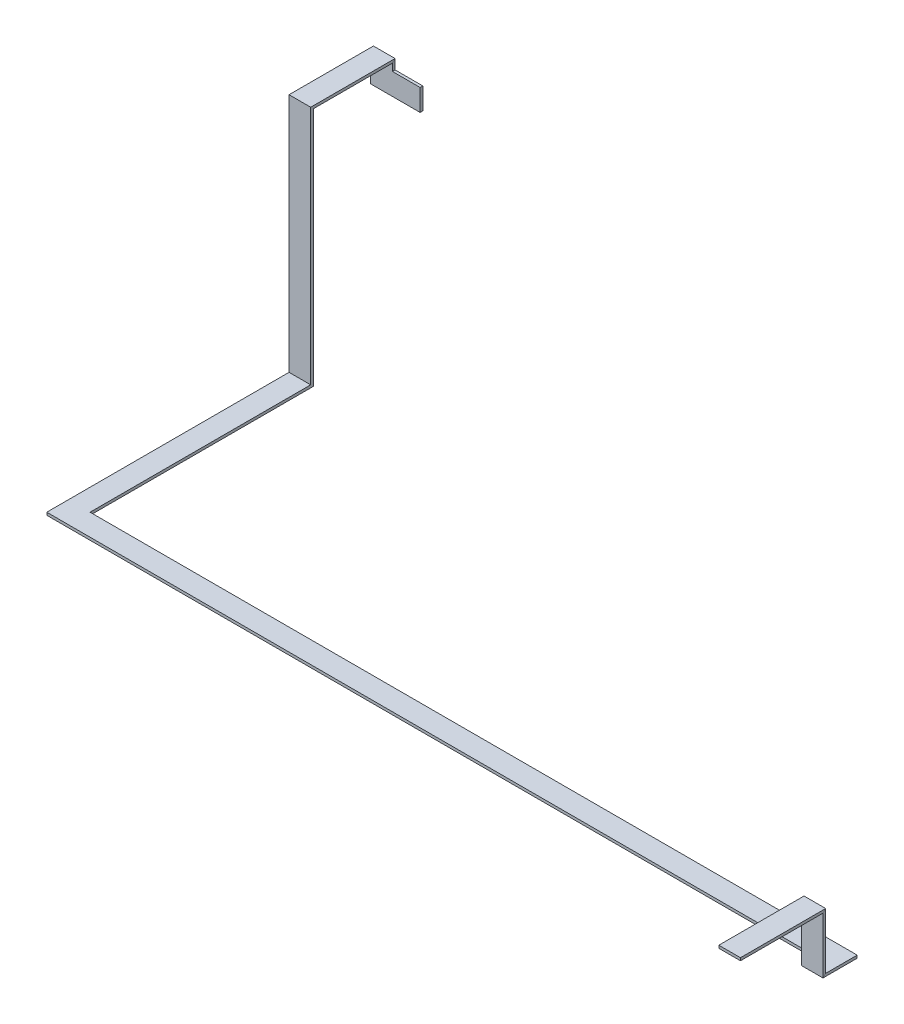
from build123d import *

# Parameters (mm, degrees)
CROQUIS2_W              = 50.8
CROQUIS2_H              = 570.39
SALIENTE_EXTRUIR1_DEPTH = 6.31
CROQUIS3_W              = 50.8
CROQUIS3_H              = 6.31
SALIENTE_EXTRUIR2_DEPTH = 568.44
CROQUIS4_W              = 50.8
CROQUIS4_H              = 6.31
SALIENTE_EXTRUIR3_DEPTH = 1800
CROQUIS6_W              = 50.8
CROQUIS6_H              = 6.31
CROQUIS9_W              = 50.8
CROQUIS9_H              = 6.31
CROQUIS10_W             = 6.31
CROQUIS10_H             = 50.8
SALIENTE_EXTRUIR4_DEPTH = 65


with BuildPart() as part:
    # Croquis2 → Saliente-Extruir1 (new body)
    with BuildSketch(Plane.XY):
        Rectangle(CROQUIS2_W, CROQUIS2_H)
    extrude(amount=SALIENTE_EXTRUIR1_DEPTH)

    # Croquis3 → Saliente-Extruir2 (add)
    with BuildSketch(Plane.XY.offset(6.31)):
        with Locations((0, -282.04)):
            Rectangle(CROQUIS3_W, CROQUIS3_H)
    extrude(amount=SALIENTE_EXTRUIR2_DEPTH)

    # Croquis4 → Saliente-Extruir3 (add)
    with BuildSketch(Plane(origin=(25.4, 0, 0), x_dir=(0, 0, -1), z_dir=(1, 0, 0))):
        with Locations((-549.35, -282.04)):
            Rectangle(CROQUIS4_W, CROQUIS4_H)
    extrude(amount=SALIENTE_EXTRUIR3_DEPTH)

    # Barrer1: sweep along a curve in space
    with BuildLine() as barrer1_path:
        Line((0, 282.04, 0), (0, 282.04, -188.52))
        Line((0, 282.04, -188.52), (0, 211.24, -188.52))
    # Croquis6 → Barrer1 (sweep)
    with BuildSketch(Plane(origin=(0, 0, 0), x_dir=(-1, 0, 0), z_dir=(0, 0, -1))):
        with Locations((0, 282.04)):
            Rectangle(CROQUIS6_W, CROQUIS6_H)
    sweep(path=barrer1_path.line, transition=Transition.RIGHT)

    # Barrer2: sweep along a curve in space
    with BuildLine() as barrer2_path:
        Line((1800, -282.04, 574.75), (1800, -282.04, 601.16))
        Line((1800, -282.04, 601.16), (1800, -150.28, 601.16))
        Line((1800, -150.28, 601.16), (1800, -150.28, 797.94))
    # Croquis9 → Barrer2 (sweep)
    with BuildSketch(Plane.XY.offset(574.75)):
        with Locations((1800, -282.04)):
            Rectangle(CROQUIS9_W, CROQUIS9_H)
    sweep(path=barrer2_path.line, transition=Transition.RIGHT)

    # Croquis10 → Saliente-Extruir4 (add)
    with BuildSketch(Plane(origin=(25.4, 0, 0), x_dir=(0, 0, -1), z_dir=(1, 0, 0))):
        with Locations((188.52, 236.64)):
            Rectangle(CROQUIS10_W, CROQUIS10_H)
    extrude(amount=SALIENTE_EXTRUIR4_DEPTH)


solid = part.part
